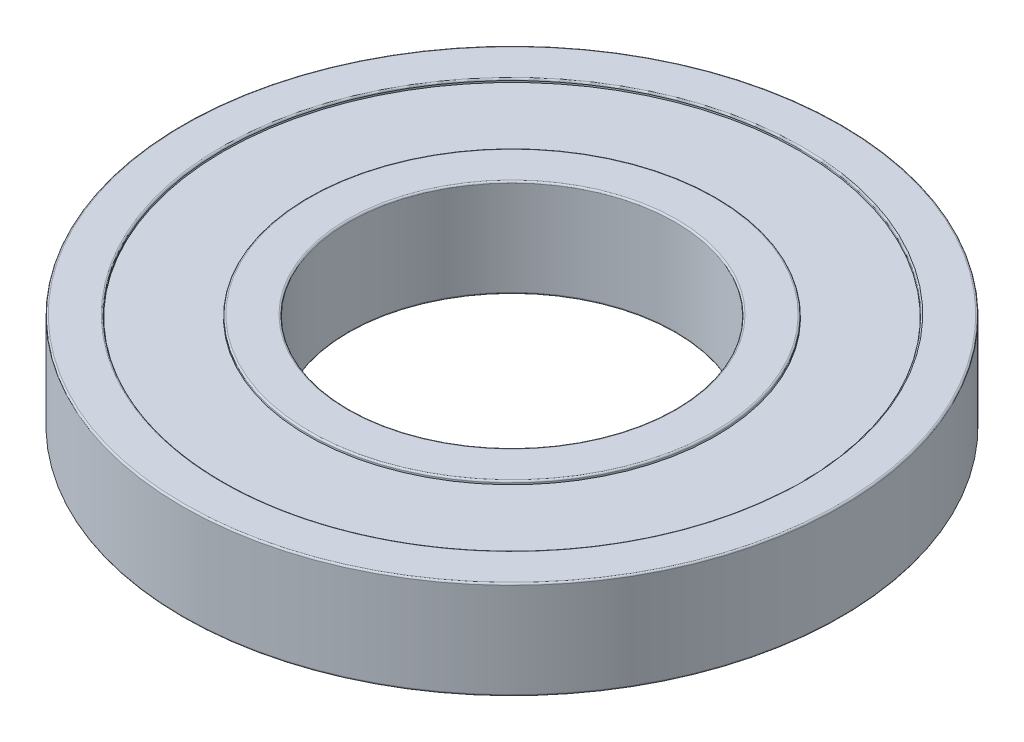
from build123d import *

# Parameters (mm, degrees)
FILLET1_R = 0.05
FILLET2_R = 0.05
SKETCH2_W = 2.598076211
SKETCH2_H = 0.1


with BuildPart() as part:
    # Sketch1 → Revolve1 (revolve)
    with BuildSketch(Plane.XY, mode=Mode.PRIVATE) as revolve1_sk:
        with BuildLine():
            Line((-5, 1.5), (-5, -1.5))
            Line((-5, -1.5), (-6.25, -1.5))
            Line((-6.25, -1.5), (-6.25, -0.75))
            ThreePointArc((-6.25, -0.75), (-6.049038106, 0), (-6.25, 0.75))
            Line((-6.25, 0.75), (-6.25, 1.5))
            Line((-6.25, 1.5), (-5, 1.5))
        make_face()
        with BuildLine():
            Line((-8.848076211, 1.5), (-8.848076211, 0.75))
            ThreePointArc((-8.848076211, 0.75), (-9.049038106, 0), (-8.848076211, -0.75))
            Line((-8.848076211, -0.75), (-8.848076211, -1.5))
            Line((-8.848076211, -1.5), (-10.098076211, -1.5))
            Line((-10.098076211, -1.5), (-10.098076211, 1.5))
            Line((-10.098076211, 1.5), (-8.848076211, 1.5))
        make_face()
    revolve(revolve1_sk.sketch.rotate(Axis((0, 0, 0), (0, 1, 0)), 270), axis=Axis((0, 0, 0), (0, 1, 0)))

    # Fillet1
    fillet1_edges = [part.edges().sort_by_distance(p)[0] for p in [
        (0, 1.5, 8.848076211),
        (0, -1.5, 8.848076211),
        (0, -1.5, 10.098076211),
        (0, 1.5, 10.098076211),
    ]]
    fillet(fillet1_edges, radius=FILLET1_R)

    # Fillet2
    fillet2_edges = [part.edges().sort_by_distance(p)[0] for p in [
        (0, 1.5, 6.25),
        (0, -1.5, 6.25),
        (0, -1.5, 5),
        (0, 1.5, 5),
    ]]
    fillet(fillet2_edges, radius=FILLET2_R)

    # Sketch2 → Revolve2 (revolve)
    with BuildSketch(Plane.XY, mode=Mode.PRIVATE) as revolve2_sk:
        with Locations((-7.549038106, 1.35)):
            Rectangle(SKETCH2_W, SKETCH2_H)
        with Locations((-7.549038106, -1.35)):
            Rectangle(SKETCH2_W, SKETCH2_H)
    revolve(revolve2_sk.sketch.rotate(Axis((0, 0, 0), (0, 1, 0)), 270), axis=Axis((0, 0, 0), (0, 1, 0)))


solid = part.part
